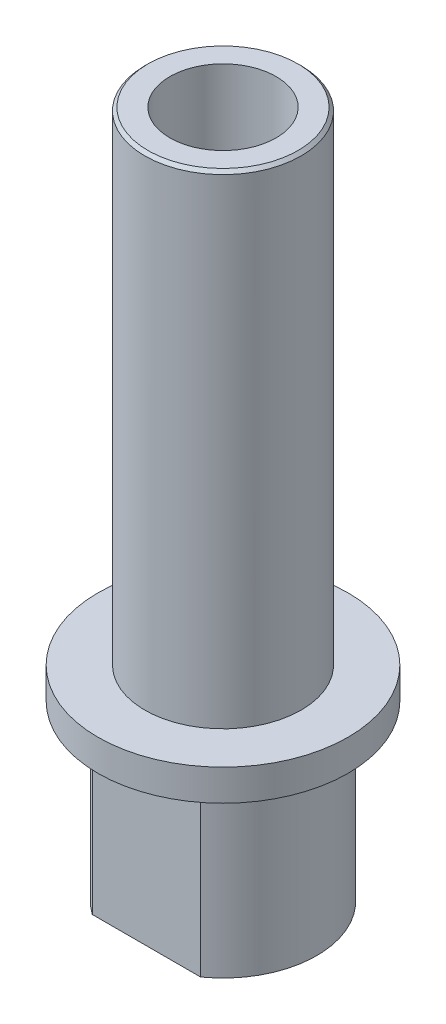
from build123d import *

# Parameters (mm, degrees)
SKETCH_2_W             = 6.925315878
SKETCH_2_H             = 1.1
CUT_EXTRUDE_1_DEPTH    = 11.1
HOLE_WIZARD_M8_1_D     = 6.8
HOLE_WIZARD_M8_1_DEPTH = 19.75
HOLE_WIZARD_M8_1_TIP   = 2.042926105
HOLE_WIZARD_M8_2_D     = 6.8
HOLE_WIZARD_M8_2_DEPTH = 19.75
HOLE_WIZARD_M8_2_TIP   = 2.042926105
CHAMFER_1_SIZE         = 0.2


with BuildPart() as part:
    # 草图1 → 旋转1 (revolve)
    with BuildSketch(Plane.XY):
        Polygon((0, 0), (6, 0), (6, 11.1), (8, 11.1), (8, 13.1), (5, 13.1), (5, 44), (0, 44), align=None)
    revolve(axis=Axis((0, -1000, 0), (0, 1, 0)))

    # 草图2 → 切除-拉伸1 (cut)
    with BuildSketch(Plane.XZ):
        with Locations((0, -5.45)):
            Rectangle(SKETCH_2_W, SKETCH_2_H)
        with Locations((0, 5.45)):
            Rectangle(SKETCH_2_W, SKETCH_2_H)
    extrude(amount=-CUT_EXTRUDE_1_DEPTH, mode=Mode.SUBTRACT)

    # M8 螺纹孔1
    with Locations(Plane(origin=(0, 44, 0), x_dir=(1, 0, 0), z_dir=(0, 1, 0))):
        with Locations((0, 0)):
            Hole(HOLE_WIZARD_M8_1_D / 2, depth=HOLE_WIZARD_M8_1_DEPTH)
            with Locations((0, 0, -(HOLE_WIZARD_M8_1_DEPTH + HOLE_WIZARD_M8_1_TIP / 2))):  # 118° drill point
                Cone(0, HOLE_WIZARD_M8_1_D / 2, HOLE_WIZARD_M8_1_TIP, mode=Mode.SUBTRACT)

    # M8 螺纹孔2
    with Locations(Plane(origin=(0, 0, 0), x_dir=(-1, 0, 0), z_dir=(0, -1, 0))):
        with Locations((0, 0)):
            Hole(HOLE_WIZARD_M8_2_D / 2, depth=HOLE_WIZARD_M8_2_DEPTH)
            with Locations((0, 0, -(HOLE_WIZARD_M8_2_DEPTH + HOLE_WIZARD_M8_2_TIP / 2))):  # 118° drill point
                Cone(0, HOLE_WIZARD_M8_2_D / 2, HOLE_WIZARD_M8_2_TIP, mode=Mode.SUBTRACT)

    # 倒角1
    chamfer_1_edges = [part.edges().sort_by_distance(p)[0] for p in [
        (-5, 44, 0),
    ]]
    chamfer(chamfer_1_edges, length=CHAMFER_1_SIZE)


solid = part.part
